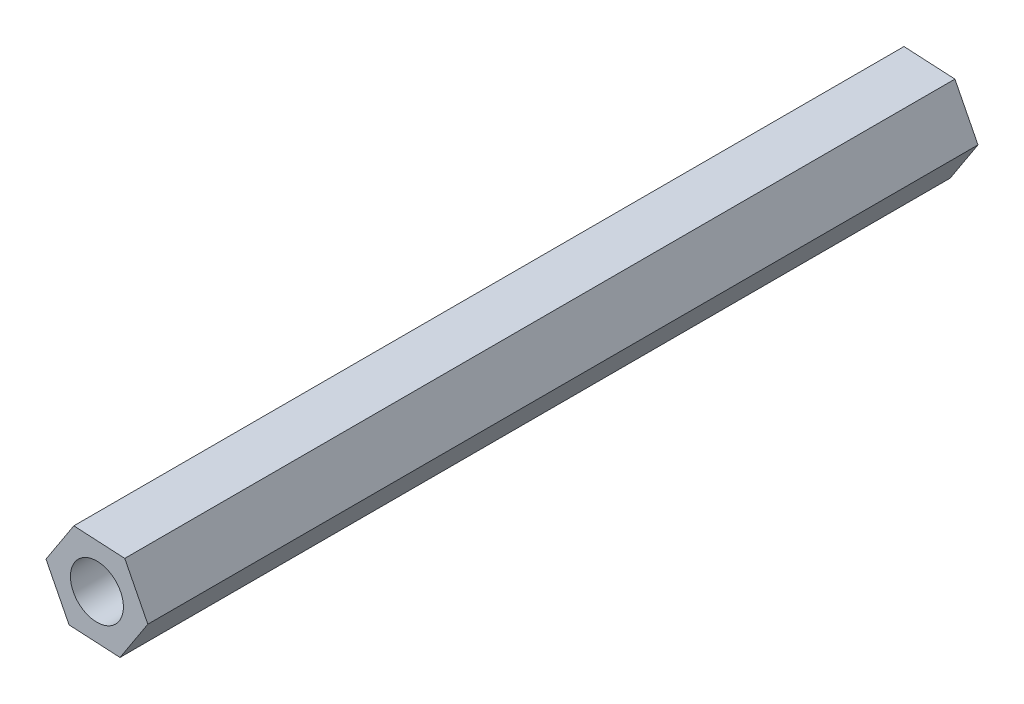
from build123d import *

# Parameters (mm, degrees)
BOSS_EXTRUDE1_DEPTH = 47
SKETCH2_R           = 1.5
CUT_EXTRUDE1_DEPTH  = 48.158605439


with BuildPart() as part:
    # Sketch1 → Boss-Extrude1 (new body)
    with BuildSketch(Plane.XY):
        Polygon((1.57545706, 2.418939517), (-1.307134542, 2.573855595), (-2.882591602, 0.154916078), (-1.57545706, -2.418939517), (1.307134542, -2.573855595), (2.882591602, -0.154916078), align=None)
    extrude(amount=BOSS_EXTRUDE1_DEPTH)

    # Sketch2 → Cut-Extrude1 (cut, through all)
    with BuildSketch(Plane(origin=(0, 0, 0), x_dir=(-1, 0, 0), z_dir=(0, 0, -1))):
        Circle(SKETCH2_R)
    extrude(amount=-CUT_EXTRUDE1_DEPTH, mode=Mode.SUBTRACT)


solid = part.part
